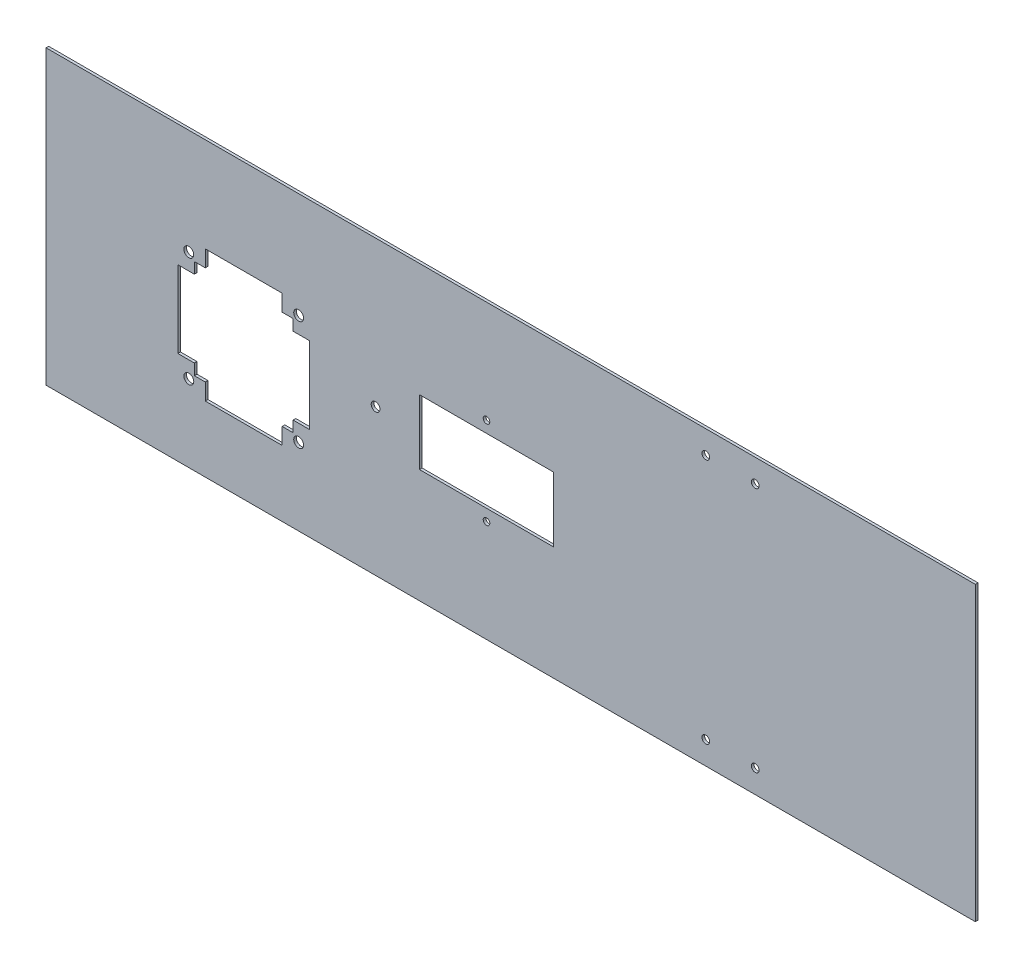
from build123d import *

# Parameters (mm, degrees)
ESQUISSE1_W        = 423
ESQUISSE1_H        = 133
ESQUISSE1_R        = 2.25
ESQUISSE1_R_2      = 1.5
ESQUISSE1_W_2      = 61
ESQUISSE1_H_2      = 29.5
ESQUISSE1_R_3      = 1.75
ESQUISSE1_R_4      = 2
BOSS_EXTRU_1_DEPTH = 1.2


with BuildPart() as part:
    # Esquisse1 → Boss.-Extru.1 (new body)
    with BuildSketch(Plane.XY):
        with Locations((-338.252753452, 101.126670585)):
            Rectangle(ESQUISSE1_W, ESQUISSE1_H)
        with Locations((-484.752753452, 69.626670585)):
            Circle(ESQUISSE1_R, mode=Mode.SUBTRACT)
        Polygon((-482.252753452, 112.126670585), (-482.252753452, 117.126670585), (-477.252753452, 117.126670585), (-477.252753452, 124.626670585), (-442.252753452, 124.626670585), (-442.252753452, 117.126670585), (-437.252753452, 117.126670585), (-437.252753452, 112.126670585), (-429.752753452, 112.126670585), (-429.752753452, 77.126670585), (-437.252753452, 77.126670585), (-437.252753452, 72.126670585), (-442.252753452, 72.126670585), (-442.252753452, 64.626670585), (-477.252753452, 64.626670585), (-477.252753452, 72.126670585), (-482.252753452, 72.126670585), (-482.252753452, 77.126670585), (-489.752753452, 77.126670585), (-489.752753452, 112.126670585), align=None, mode=Mode.SUBTRACT)
        with Locations((-434.752753452, 69.626670585)):
            Circle(ESQUISSE1_R, mode=Mode.SUBTRACT)
        with Locations((-349.252753452, 81.126670585)):
            Circle(ESQUISSE1_R_2, mode=Mode.SUBTRACT)
        with Locations((-349.252753452, 101.126670585)):
            Rectangle(ESQUISSE1_W_2, ESQUISSE1_H_2, mode=Mode.SUBTRACT)
        with Locations((-249.451641066, 45.126670585)):
            Circle(ESQUISSE1_R_3, mode=Mode.SUBTRACT)
        with Locations((-226.951641066, 45.126670585)):
            Circle(ESQUISSE1_R_3, mode=Mode.SUBTRACT)
        with Locations((-484.752753452, 119.626670585)):
            Circle(ESQUISSE1_R, mode=Mode.SUBTRACT)
        with Locations((-399.752753452, 101.126670585)):
            Circle(ESQUISSE1_R_4, mode=Mode.SUBTRACT)
        with Locations((-434.752753452, 119.626670585)):
            Circle(ESQUISSE1_R, mode=Mode.SUBTRACT)
        with Locations((-349.252753452, 121.126670585)):
            Circle(ESQUISSE1_R_2, mode=Mode.SUBTRACT)
        with Locations((-249.451641066, 157.126670585)):
            Circle(ESQUISSE1_R_3, mode=Mode.SUBTRACT)
        with Locations((-226.951641066, 157.126670585)):
            Circle(ESQUISSE1_R_3, mode=Mode.SUBTRACT)
    extrude(amount=BOSS_EXTRU_1_DEPTH)


solid = part.part
